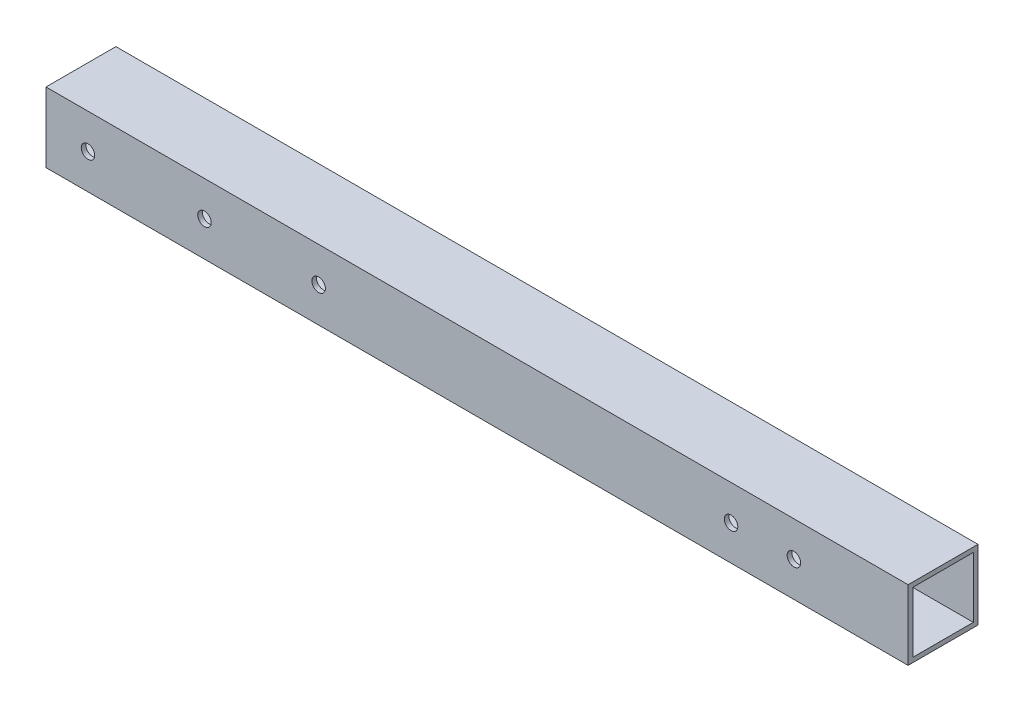
from build123d import *

# Parameters (mm, degrees)
SKETCH_1_W          = 15
SKETCH_1_H          = 15
SKETCH_1_W_2        = 13
SKETCH_1_H_2        = 13
EXTRUDE_1_DEPTH     = 185
SKETCH_2_R          = 1.45
CUT_EXTRUDE_1_DEPTH = 186.758579883


with BuildPart() as part:
    # 草图1 → 凸台-拉伸1 (new body)
    with BuildSketch(Plane(origin=(0, 0, 0), x_dir=(0, 0, -1), z_dir=(1, 0, 0))):
        Rectangle(SKETCH_1_W, SKETCH_1_H)
        Rectangle(SKETCH_1_W_2, SKETCH_1_H_2, mode=Mode.SUBTRACT)
    extrude(amount=EXTRUDE_1_DEPTH)

    # 草图2 → 切除-拉伸1 (cut, through all)
    with BuildSketch(Plane(origin=(0, 0, -7.5), x_dir=(-1, 0, 0), z_dir=(0, 0, -1))):
        with Locations((-9.010396093, 0)):
            Circle(SKETCH_2_R)
        with Locations((-160.5, 0)):
            Circle(SKETCH_2_R)
        with Locations((-147, 0)):
            Circle(SKETCH_2_R)
        with Locations((-58.5, 0)):
            Circle(SKETCH_2_R)
        with Locations((-34.010396093, 0)):
            Circle(SKETCH_2_R)
    extrude(amount=-CUT_EXTRUDE_1_DEPTH, mode=Mode.SUBTRACT)


solid = part.part
